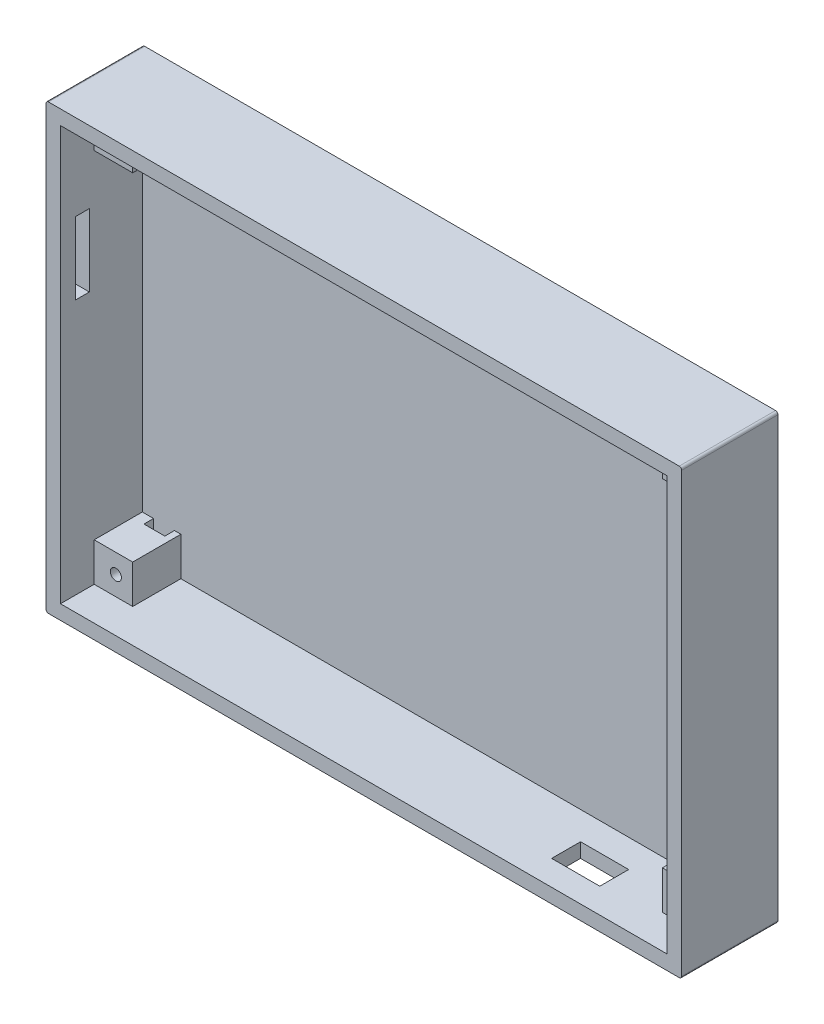
from build123d import *

# Parameters (mm, degrees)
BOSS_EXTRU_1_DEPTH       = 18
BOSS_EXTRU_1_DEPTH_BACK  = 2
ESQUISSE1_W              = 132
ESQUISSE1_H              = 92
ENL_V_START              = -3
ESQUISSE14_W             = 126
ESQUISSE14_H             = 86
ENL_V_MAT_EXTRU_1_DEPTH  = 121.109755351
ESQUISSE15_W             = 8
ESQUISSE15_H             = 10
BOSS_EXTRU_2_DEPTH       = 8
ESQUISSE16_W             = 8
ESQUISSE16_H             = 10
BOSS_EXTRU_3_DEPTH       = 8
ESQUISSE17_W             = 8
ESQUISSE17_H             = 10
BOSS_EXTRU_4_DEPTH       = 8
ESQUISSE18_W             = 8
ESQUISSE18_H             = 10
BOSS_EXTRU_5_DEPTH       = 8
ESQUISSE19_R             = 1.15
ENL_V_MAT_EXTRU_2_DEPTH  = 10
ESQUISSE20_R             = 1.15
ENL_V_MAT_EXTRU_3_DEPTH  = 10
ESQUISSE21_R             = 1.15
ENL_V_MAT_EXTRU_4_DEPTH  = 10
ESQUISSE22_R             = 1.15
ENL_V_MAT_EXTRU_5_DEPTH  = 10
ENL_V_START_2            = -8
ENL_V_MAT_EXTRU_6_DEPTH  = 2
ESQUISSE24_W             = 4.34
ESQUISSE24_H             = 2
ENL_V_MAT_EXTRU_7_DEPTH  = 3
ENL_V_MAT_EXTRU_8_DEPTH  = 2
ESQUISSE26_W             = 4.34
ESQUISSE26_H             = 2
ENL_V_MAT_EXTRU_9_DEPTH  = 3
ENL_V_MAT_EXTRU_10_DEPTH = 2
ESQUISSE28_W             = 4.34
ESQUISSE28_H             = 2
ENL_V_MAT_EXTRU_11_DEPTH = 3
ENL_V_MAT_EXTRU_12_DEPTH = 2
ESQUISSE30_W             = 4.34
ESQUISSE30_H             = 2
ENL_V_MAT_EXTRU_13_DEPTH = 3
ESQUISSE31_W             = 10
ESQUISSE31_H             = 6
ENL_V_MAT_EXTRU_14_DEPTH = 3
ESQUISSE32_W             = 2.85
ESQUISSE32_H             = 15
ENL_V_MAT_EXTRU_15_DEPTH = 3
CONG_1_R                 = 0.5
CONG_2_R                 = 0.5
CONG_3_R                 = 0.5
CONG_4_R                 = 0.5


with BuildPart() as part:
    # Esquisse1 → Boss.-Extru.1 (new, two sides: drawn at the far end of the back side and taken through both)
    with BuildSketch(Plane.XY.offset(-BOSS_EXTRU_1_DEPTH_BACK)):
        with Locations((33.534709402, 23.633709415)):
            Rectangle(ESQUISSE1_W, ESQUISSE1_H)
    extrude(amount=BOSS_EXTRU_1_DEPTH + BOSS_EXTRU_1_DEPTH_BACK)

    # Esquisse14 → Enlèv. mat.-Extru.1 (cut, through all)
    with BuildSketch(Plane(origin=(0, 0, -2), x_dir=(-1, 0, 0), z_dir=(0, 0, -1)).offset(ENL_V_START)):
        with Locations((-33.534709402, 23.633709415)):
            Rectangle(ESQUISSE14_W, ESQUISSE14_H)
    extrude(amount=-ENL_V_MAT_EXTRU_1_DEPTH, mode=Mode.SUBTRACT)

    # Esquisse15 → Boss.-Extru.2 (add)
    with BuildSketch(Plane(origin=(0, 66.633709415, 0), x_dir=(-1, 0, 0), z_dir=(0, -1, 0))):
        with Locations((25.465290598, -6)):
            Rectangle(ESQUISSE15_W, ESQUISSE15_H)
    extrude(amount=BOSS_EXTRU_2_DEPTH)

    # Esquisse16 → Boss.-Extru.3 (add)
    with BuildSketch(Plane(origin=(0, 66.633709415, 0), x_dir=(-1, 0, 0), z_dir=(0, -1, 0))):
        with Locations((-92.534709402, -6)):
            Rectangle(ESQUISSE16_W, ESQUISSE16_H)
    extrude(amount=BOSS_EXTRU_3_DEPTH)

    # Esquisse17 → Boss.-Extru.4 (add)
    with BuildSketch(Plane(origin=(0, -19.366290585, 0), x_dir=(1, 0, 0), z_dir=(0, 1, 0))):
        with Locations((92.534709402, -6)):
            Rectangle(ESQUISSE17_W, ESQUISSE17_H)
    extrude(amount=BOSS_EXTRU_4_DEPTH)

    # Esquisse18 → Boss.-Extru.5 (add)
    with BuildSketch(Plane(origin=(0, -19.366290585, 0), x_dir=(1, 0, 0), z_dir=(0, 1, 0))):
        with Locations((-25.465290598, -6)):
            Rectangle(ESQUISSE18_W, ESQUISSE18_H)
    extrude(amount=BOSS_EXTRU_5_DEPTH)

    # Esquisse19 → Enlèv. mat.-Extru.2 (cut)
    with BuildSketch(Plane.XY.offset(11)):
        with Locations((92.034709402, -15.366290585)):
            Circle(ESQUISSE19_R)
    extrude(amount=-ENL_V_MAT_EXTRU_2_DEPTH, mode=Mode.SUBTRACT)

    # Esquisse20 → Enlèv. mat.-Extru.3 (cut)
    with BuildSketch(Plane.XY.offset(11)):
        with Locations((-24.965290598, -15.366290585)):
            Circle(ESQUISSE20_R)
    extrude(amount=-ENL_V_MAT_EXTRU_3_DEPTH, mode=Mode.SUBTRACT)

    # Esquisse21 → Enlèv. mat.-Extru.4 (cut)
    with BuildSketch(Plane.XY.offset(11)):
        with Locations((-24.965290598, 61.633709415)):
            Circle(ESQUISSE21_R)
    extrude(amount=-ENL_V_MAT_EXTRU_4_DEPTH, mode=Mode.SUBTRACT)

    # Esquisse22 → Enlèv. mat.-Extru.5 (cut)
    with BuildSketch(Plane.XY.offset(11)):
        with Locations((92.034709402, 61.633709415)):
            Circle(ESQUISSE22_R)
    extrude(amount=-ENL_V_MAT_EXTRU_5_DEPTH, mode=Mode.SUBTRACT)

    # Esquisse23 → Enlèv. mat.-Extru.6 (cut)
    with BuildSketch(Plane.XY.offset(11).offset(ENL_V_START_2)):
        Polygon((89.869645893, -14.116290585), (89.869645893, -16.616290585), (92.034709402, -17.866290585), (94.199772912, -16.616290585), (94.199772912, -14.116290585), (92.034709402, -12.866290585), align=None)
    extrude(amount=-ENL_V_MAT_EXTRU_6_DEPTH, mode=Mode.SUBTRACT)

    # Esquisse24 → Enlèv. mat.-Extru.7 (cut)
    with BuildSketch(Plane(origin=(0, -11.366290585, 0), x_dir=(1, 0, 0), z_dir=(0, 1, 0))):
        with Locations((92.034709402, -2)):
            Rectangle(ESQUISSE24_W, ESQUISSE24_H)
    extrude(amount=-ENL_V_MAT_EXTRU_7_DEPTH, mode=Mode.SUBTRACT)

    # Esquisse25 → Enlèv. mat.-Extru.8 (cut)
    with BuildSketch(Plane.XY.offset(11).offset(ENL_V_START_2)):
        Polygon((-22.800227088, -14.116290585), (-24.965290598, -12.866290585), (-27.130354107, -14.116290585), (-27.130354107, -16.616290585), (-24.965290598, -17.866290585), (-22.800227088, -16.616290585), align=None)
    extrude(amount=-ENL_V_MAT_EXTRU_8_DEPTH, mode=Mode.SUBTRACT)

    # Esquisse26 → Enlèv. mat.-Extru.9 (cut)
    with BuildSketch(Plane(origin=(0, -11.366290585, 0), x_dir=(1, 0, 0), z_dir=(0, 1, 0))):
        with Locations((-24.965290598, -2)):
            Rectangle(ESQUISSE26_W, ESQUISSE26_H)
    extrude(amount=-ENL_V_MAT_EXTRU_9_DEPTH, mode=Mode.SUBTRACT)

    # Esquisse27 → Enlèv. mat.-Extru.10 (cut)
    with BuildSketch(Plane.XY.offset(11).offset(ENL_V_START_2)):
        Polygon((-24.965290598, 59.133709415), (-22.800227088, 60.383709415), (-22.800227088, 62.883709415), (-24.965290598, 64.133709415), (-27.130354107, 62.883709415), (-27.130354107, 60.383709415), align=None)
    extrude(amount=-ENL_V_MAT_EXTRU_10_DEPTH, mode=Mode.SUBTRACT)

    # Esquisse28 → Enlèv. mat.-Extru.11 (cut)
    with BuildSketch(Plane(origin=(0, 58.633709415, 0), x_dir=(-1, 0, 0), z_dir=(0, -1, 0))):
        with Locations((24.965290598, -2)):
            Rectangle(ESQUISSE28_W, ESQUISSE28_H)
    extrude(amount=-ENL_V_MAT_EXTRU_11_DEPTH, mode=Mode.SUBTRACT)

    # Esquisse29 → Enlèv. mat.-Extru.12 (cut)
    with BuildSketch(Plane.XY.offset(11).offset(ENL_V_START_2)):
        Polygon((89.869645893, 60.383709415), (92.034709402, 59.133709415), (94.199772912, 60.383709415), (94.199772912, 62.883709415), (92.034709402, 64.133709415), (89.869645893, 62.883709415), align=None)
    extrude(amount=-ENL_V_MAT_EXTRU_12_DEPTH, mode=Mode.SUBTRACT)

    # Esquisse30 → Enlèv. mat.-Extru.13 (cut)
    with BuildSketch(Plane(origin=(0, 58.633709415, 0), x_dir=(-1, 0, 0), z_dir=(0, -1, 0))):
        with Locations((-92.034709402, -2)):
            Rectangle(ESQUISSE30_W, ESQUISSE30_H)
    extrude(amount=-ENL_V_MAT_EXTRU_13_DEPTH, mode=Mode.SUBTRACT)

    # Esquisse31 → Enlèv. mat.-Extru.14 (cut)
    with BuildSketch(Plane(origin=(0, -19.366290585, 0), x_dir=(1, 0, 0), z_dir=(0, 1, 0))):
        with Locations((72.334709402, -9.8)):
            Rectangle(ESQUISSE31_W, ESQUISSE31_H)
    extrude(amount=-ENL_V_MAT_EXTRU_14_DEPTH, mode=Mode.SUBTRACT)

    # Esquisse32 → Enlèv. mat.-Extru.15 (cut)
    with BuildSketch(Plane(origin=(-29.465290598, 0, 0), x_dir=(0, 0, -1), z_dir=(1, 0, 0))):
        with Locations((-13.425, 41.203709415)):
            Rectangle(ESQUISSE32_W, ESQUISSE32_H)
    extrude(amount=-ENL_V_MAT_EXTRU_15_DEPTH, mode=Mode.SUBTRACT)

    # Congé1
    cong_1_edges = [part.edges().sort_by_distance(p)[0] for p in [
        (-32.465290598, 69.633709415, 8),
    ]]
    fillet(cong_1_edges, radius=CONG_1_R)

    # Congé2
    cong_2_edges = [part.edges().sort_by_distance(p)[0] for p in [
        (-32.465290598, -22.366290585, 8),
    ]]
    fillet(cong_2_edges, radius=CONG_2_R)

    # Congé3
    cong_3_edges = [part.edges().sort_by_distance(p)[0] for p in [
        (99.534709402, -22.366290585, 8),
    ]]
    fillet(cong_3_edges, radius=CONG_3_R)

    # Congé4
    cong_4_edges = [part.edges().sort_by_distance(p)[0] for p in [
        (99.534709402, 69.633709415, 8),
    ]]
    fillet(cong_4_edges, radius=CONG_4_R)


solid = part.part
